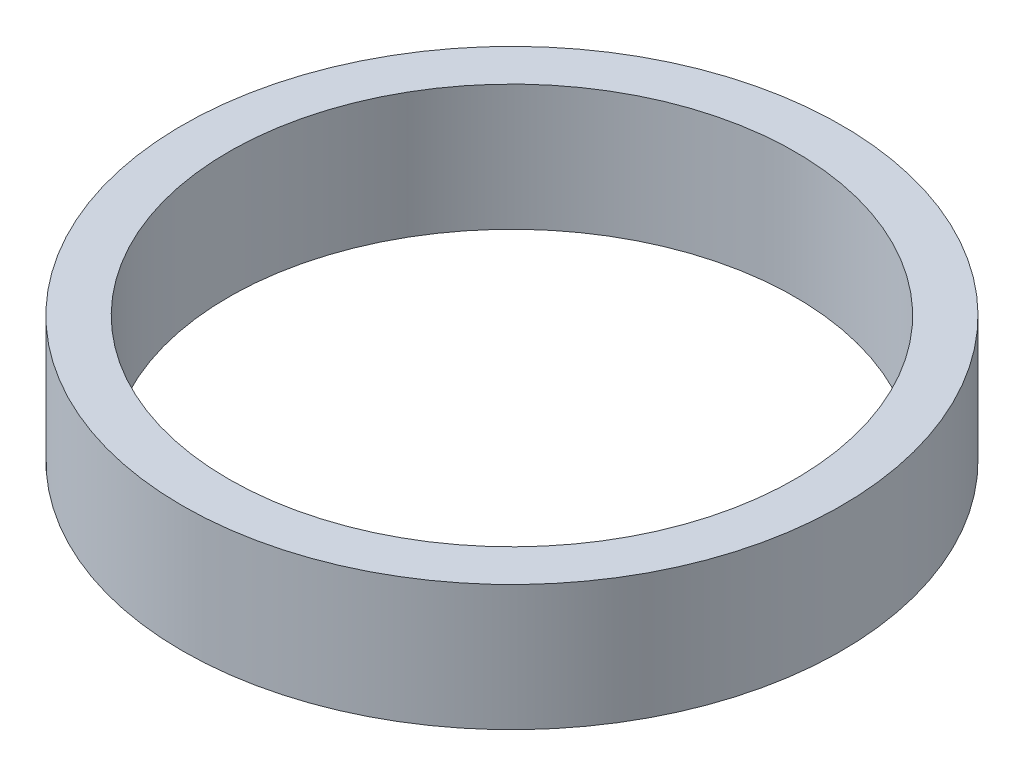
from build123d import *

# Parameters (mm, degrees)
SKETCH_1_R      = 10.485
SKETCH_1_R_2    = 9.015
EXTRUDE_1_DEPTH = 4


with BuildPart() as part:
    # 草图1 → 凸台-拉伸1 (new body)
    with BuildSketch(Plane(origin=(0, 0, 0), x_dir=(1, 0, 0), z_dir=(0, 1, 0))):
        with Locations(Location((0, 0, 0), (0, 0, 270))):
            Circle(SKETCH_1_R)
        with Locations(Location((0, 0, 0), (0, 0, 270))):
            Circle(SKETCH_1_R_2, mode=Mode.SUBTRACT)
    extrude(amount=EXTRUDE_1_DEPTH)


solid = part.part
